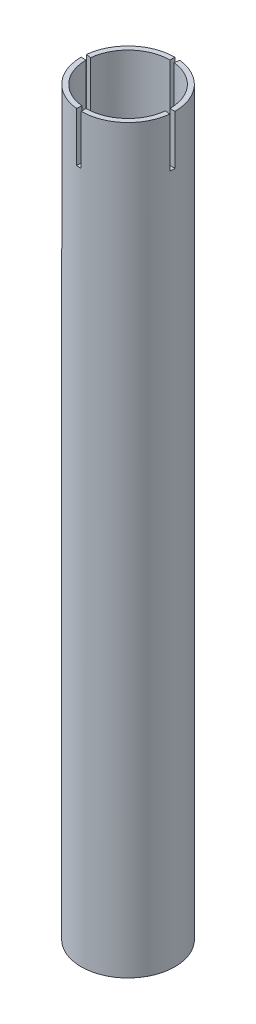
from build123d import *

# Parameters (mm, degrees)
SKETCH_1_R               = 19
SKETCH_1_R_2             = 17
EXTRUDE_1_DEPTH          = 300
CUT_EXTRUDE_1_DEPTH      = 20
PATTERN_CIRCULAR_1_COUNT = 4


with BuildPart() as part:
    # 草图1 → 拉伸-薄壁1 (new body)
    with BuildSketch(Plane(origin=(0, 0, 0), x_dir=(1, 0, 0), z_dir=(0, 1, 0))):
        Circle(SKETCH_1_R)
        Circle(SKETCH_1_R_2, mode=Mode.SUBTRACT)
    extrude(amount=EXTRUDE_1_DEPTH)

    # 草图3 → 切除-拉伸1 (cut)
    with BuildSketch(Plane(origin=(0, 300, 0), x_dir=(1, 0, 0), z_dir=(0, 1, 0))):
        Polygon((0, 0), (0, 19), (2, 19), align=None)
    cut_extrude_1 = extrude(amount=-CUT_EXTRUDE_1_DEPTH, mode=Mode.SUBTRACT)

    # 阵列(圆周)1: 切除-拉伸1 ×4 about axis
    pattern_circular_1_axis = Axis((0, 300, 0), (0, -1, 0))
    for i in range(1, PATTERN_CIRCULAR_1_COUNT):
        add(cut_extrude_1.rotate(pattern_circular_1_axis, i * 360 / PATTERN_CIRCULAR_1_COUNT), mode=Mode.SUBTRACT)


solid = part.part
